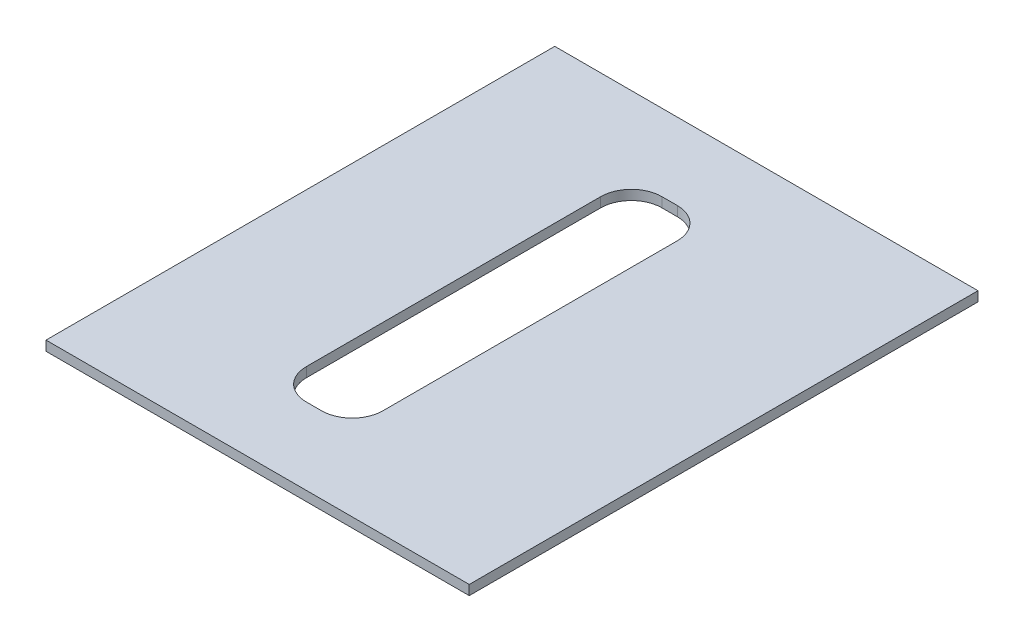
from build123d import *

# Parameters (mm, degrees)
SKETCH1_W           = 138.2
SKETCH1_H           = 166.124
BOSS_EXTRUDE1_DEPTH = 3.175


with BuildPart() as part:
    # Sketch1 → Boss-Extrude1 (new body)
    with BuildSketch(Plane(origin=(0, 0, 0), x_dir=(1, 0, 0), z_dir=(0, 1, 0))):
        with Locations((69.1, 83.062)):
            Rectangle(SKETCH1_W, SKETCH1_H)
        with BuildLine():
            Line((60, 141.124), (65, 141.124))
            ThreePointArc((65, 141.124), (72.071067812, 138.195067812), (75, 131.124))
            Line((75, 131.124), (75, 35))
            ThreePointArc((75, 35), (72.071067812, 27.928932188), (65, 25))
            Line((65, 25), (60, 25))
            ThreePointArc((60, 25), (52.928932188, 27.928932188), (50, 35))
            Line((50, 35), (50, 131.124))
            ThreePointArc((50, 131.124), (52.928932188, 138.195067812), (60, 141.124))
        make_face(mode=Mode.SUBTRACT)
    extrude(amount=BOSS_EXTRUDE1_DEPTH)


solid = part.part
